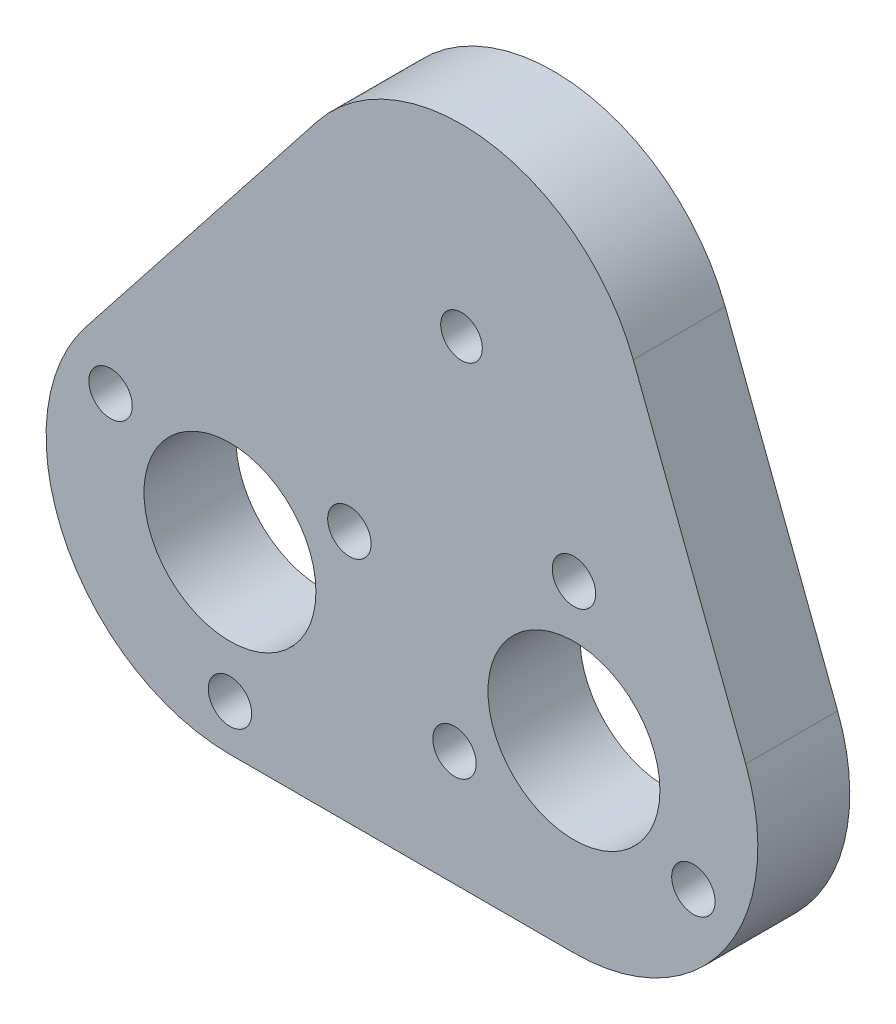
from build123d import *

# Parameters (mm, degrees)
SKETCH1_R           = 5.9375
SKETCH1_R_2         = 1.4375
BOSS_EXTRUDE1_DEPTH = 6.35
SKETCH8_R           = 1.5
CUT_EXTRUDE1_DEPTH  = 45.18177233


with BuildPart() as part:
    # Sketch1 → Boss-Extrude1 (new body)
    with BuildSketch(Plane.XY):
        with BuildLine():
            ThreePointArc((-25.965833293, -12.433096966), (-27.416705459, -25.837023258), (-15.990529394, -32.993333104))
            Line((-15.990529394, -32.993333104), (7.766045394, -32.993333104))
            ThreePointArc((7.766045394, -32.993333104), (18.228763262, -27.492050685), (19.627171546, -15.754204728))
            Line((19.627171546, -15.754204728), (11.861126152, 4.539128375))
            ThreePointArc((11.861126152, 4.539128375), (1.909586496, 12.555615453), (-9.975303898, 7.860236137))
            Line((-9.975303898, 7.860236137), (-25.965833293, -12.433096966))
        make_face()
        with Locations((-15.990529394, -20.293333104)):
            Circle(SKETCH1_R, mode=Mode.SUBTRACT)
        Circle(SKETCH1_R_2, mode=Mode.SUBTRACT)
        with Locations((7.766045394, -20.293333104)):
            Circle(SKETCH1_R, mode=Mode.SUBTRACT)
    extrude(amount=BOSS_EXTRUDE1_DEPTH)

    # Sketch8 → Cut-Extrude1 (cut, through all)
    with BuildSketch(Plane.XY.offset(6.35)):
        with Locations((7.766045394, -10.768333104)):
            Circle(SKETCH8_R)
        with Locations((-15.990529394, -29.818333104)):
            Circle(SKETCH8_R)
        with Locations((-24.239421365, -15.530833104)):
            Circle(SKETCH8_R)
        with Locations((-7.741637423, -15.530833104)):
            Circle(SKETCH8_R)
        with Locations((16.014937365, -25.055833104)):
            Circle(SKETCH8_R)
        with Locations((-0.482846577, -25.055833104)):
            Circle(SKETCH8_R)
    extrude(amount=-CUT_EXTRUDE1_DEPTH, mode=Mode.SUBTRACT)


solid = part.part
